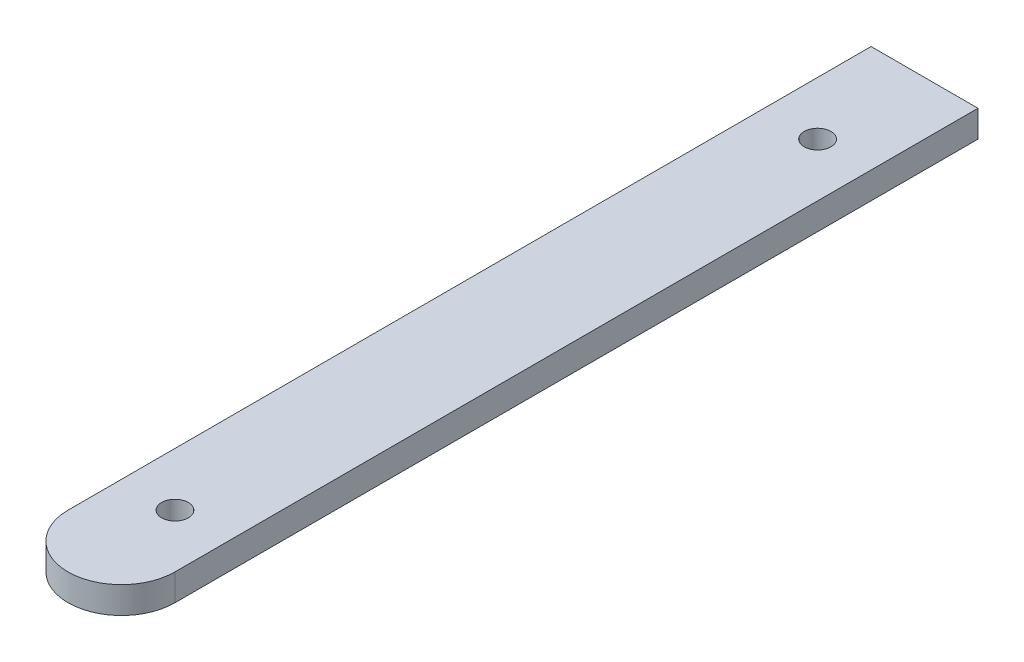
from build123d import *

# Parameters (mm, degrees)
SKETCH1_W           = 25.4
SKETCH1_H           = 203.454
SKETCH1_R           = 3.175
BOSS_EXTRUDE1_DEPTH = 6.35
FILLET1_RADIUS      = 12.7
FILLET1_LENGTH      = 6.35


with BuildPart() as part:
    # Sketch1 → Boss-Extrude1 (new body)
    with BuildSketch(Plane(origin=(0, 0, 0), x_dir=(1, 0, 0), z_dir=(0, 1, 0))):
        with Locations((6.296638655, -73.658932773)):
            Rectangle(SKETCH1_W, SKETCH1_H)
        with Locations(Location((6.296638655, 2.668067227, 0), (0, 0, 270))):
            Circle(SKETCH1_R, mode=Mode.SUBTRACT)
        with Locations(Location((6.296638655, -149.985932773, 0), (0, 0, 270))):
            Circle(SKETCH1_R, mode=Mode.SUBTRACT)
    extrude(amount=BOSS_EXTRUDE1_DEPTH)

    # Fillet1: full round fillet: the end face becomes a half cylinder, R = half its width
    fillet1_face = Plane((6.296638655, 3.175, 175.385932773), x_dir=(0, 1, 0), z_dir=(0, 0, 1))  # on the end face: x along it, z out of the body
    fillet1_slab = fillet1_face.offset(-FILLET1_RADIUS / 2) * Box(FILLET1_LENGTH, 2 * FILLET1_RADIUS, FILLET1_RADIUS, mode=Mode.PRIVATE)  # the body's end, R deep
    fillet1_round = Plane((6.296638655, 3.175, 162.685932773), x_dir=(0, 0, 1), z_dir=(0, 1, 0)) * Cylinder(FILLET1_RADIUS, FILLET1_LENGTH, mode=Mode.PRIVATE)  # its axis R under the face
    add(fillet1_slab - fillet1_round, mode=Mode.SUBTRACT)


solid = part.part
